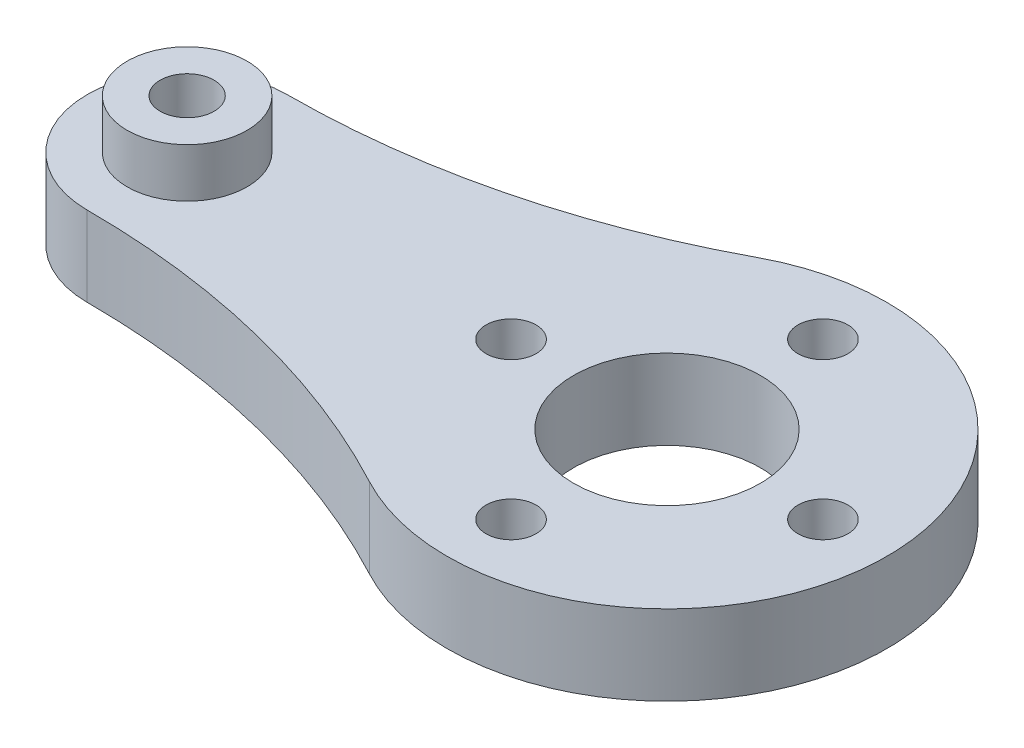
from build123d import *

# Parameters (mm, degrees)
SKETCH1_R           = 1.25
SKETCH1_R_2         = 1.35
SKETCH1_R_3         = 4.675
BOSS_EXTRUDE2_DEPTH = 4
SKETCH2_R           = 2.75
CUT_EXTRUDE1_DEPTH  = 1
SKETCH4_R           = 3
SKETCH4_R_2         = 1.35
BOSS_EXTRUDE3_DEPTH = 2.45


with BuildPart() as part:
    # Sketch1 → Boss-Extrude2 (new body)
    with BuildSketch(Plane(origin=(0, 0, 0), x_dir=(1, 0, 0), z_dir=(0, 1, 0))):
        with BuildLine():
            ThreePointArc((6.823529412, -9.705882353), (23, 0), (6.823529412, 9.705882353))
            ThreePointArc((6.823529412, 9.705882353), (-2.298574999, 6.194299994), (-12, 5))
            ThreePointArc((-12, 5), (-17, 0), (-12, -5))
            ThreePointArc((-12, -5), (-2.298574999, -6.194299994), (6.823529412, -9.705882353))
        make_face()
        with Locations(Location((4.2, 0, 0), (0, 0, 270))):
            Circle(SKETCH1_R, mode=Mode.SUBTRACT)
        with Locations(Location((-12, 0, 0), (0, 0, 270))):
            Circle(SKETCH1_R_2, mode=Mode.SUBTRACT)
        with Locations(Location((12, 7.8, 0), (0, 0, 270))):
            Circle(SKETCH1_R, mode=Mode.SUBTRACT)
        with Locations(Location((19.8, 0, 0), (0, 0, 270))):
            Circle(SKETCH1_R, mode=Mode.SUBTRACT)
        with Locations(Location((12, -7.8, 0), (0, 0, 270))):
            Circle(SKETCH1_R, mode=Mode.SUBTRACT)
        with Locations(Location((12, 0, 0), (0, 0, 270))):
            Circle(SKETCH1_R_3, mode=Mode.SUBTRACT)
    extrude(amount=BOSS_EXTRUDE2_DEPTH)

    # Sketch2 → Cut-Extrude1 (cut)
    with BuildSketch(Plane.XZ):
        with Locations(Location((12, -7.8, 0), (0, 0, 270))):
            Circle(SKETCH2_R)
        with Locations(Location((4.2, 0, 0), (0, 0, 270))):
            Circle(SKETCH2_R)
        with Locations(Location((12, 7.8, 0), (0, 0, 270))):
            Circle(SKETCH2_R)
        with Locations(Location((19.8, 0, 0), (0, 0, 270))):
            Circle(SKETCH2_R)
    extrude(amount=-CUT_EXTRUDE1_DEPTH, mode=Mode.SUBTRACT)

    # Sketch4 → Boss-Extrude3 (add)
    with BuildSketch(Plane(origin=(0, 4, 0), x_dir=(1, 0, 0), z_dir=(0, 1, 0))):
        with Locations(Location((-12, 0, 0), (0, 0, 270))):
            Circle(SKETCH4_R)
        with Locations(Location((-12, 0, 0), (0, 0, 270))):
            Circle(SKETCH4_R_2, mode=Mode.SUBTRACT)
    extrude(amount=BOSS_EXTRUDE3_DEPTH)


solid = part.part
